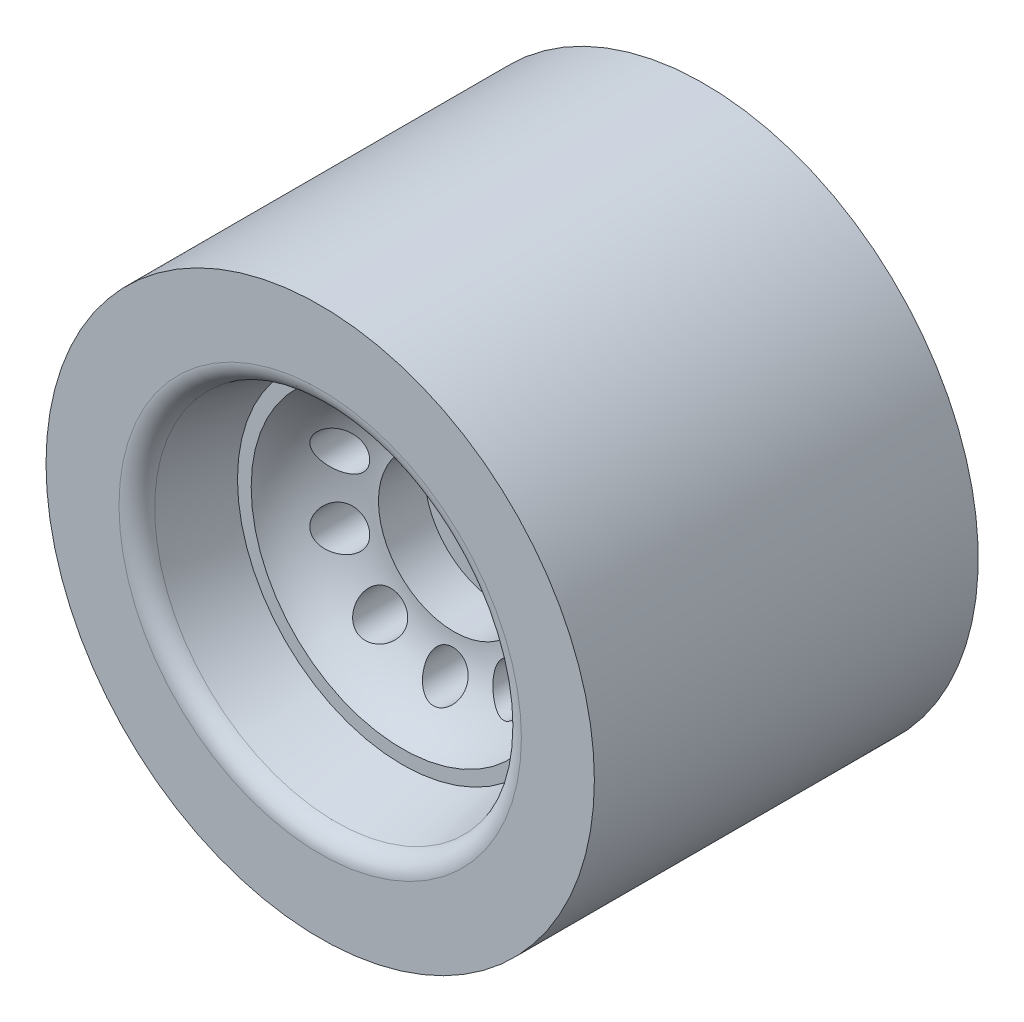
from build123d import *

# Parameters (mm, degrees)
SKETCH_1_R               = 40
EXTRUDE_1_DEPTH          = 28
SKETCH_2_R               = 8.5
CUT_EXTRUDE_1_DEPTH      = 80.598994969
SKETCH_5_R               = 3
CUT_EXTRUDE_2_DEPTH      = 64.118935352
PATTERN_CIRCULAR_1_COUNT = 10
FILLET_1_R               = 3
SKETCH_6_R               = 11
CUT_EXTRUDE_3_DEPTH      = 6.75
CUT_EXTRUDE_START        = -6.75
SKETCH_7_R               = 11
CUT_EXTRUDE_4_DEPTH      = 6.75


with BuildPart() as part:
    # 스케치1 → 보스-돌출1 (new, symmetric)
    with BuildSketch(Plane.XY):
        Circle(SKETCH_1_R)
    extrude(amount=EXTRUDE_1_DEPTH, both=True)

    # 스케치2 → 컷-돌출1 (cut, through all)
    with BuildSketch(Plane.XY.offset(28)):
        Circle(SKETCH_2_R)
    extrude(amount=-CUT_EXTRUDE_1_DEPTH, mode=Mode.SUBTRACT)

    # 스케치4 → 컷-회전1 (revolve, cut)
    with BuildSketch(Plane(origin=(0, 0, 0), x_dir=(0, 0, -1), z_dir=(1, 0, 0)), mode=Mode.PRIVATE) as cut_revolve_1_sk:
        with BuildLine():
            Line((28, 40), (26.6, 33.9))
            Line((26.6, 33.9), (25.6, 33.4))
            ThreePointArc((25.6, 33.4), (25.036621757, 30.988428707), (24.205776693, 28.655454719))
            ThreePointArc((24.205776693, 28.655454719), (23.141333629, 25.422089147), (22.6083716, 22.06))
            ThreePointArc((22.6083716, 22.06), (17.154433029, 17.683921829), (15.1, 11))
            Line((15.1, 11), (15.1, 0))
            Line((15.1, 0), (28, 0))
            Line((28, 0), (28, 40))
        make_face()
        with BuildLine():
            Line((-28, 0), (-28, 27))
            Line((-28, 27), (-16.0083716, 24.06))
            Line((-16.0083716, 24.06), (-16.0083716, 22.06))
            ThreePointArc((-16.0083716, 22.06), (-10.554433029, 17.683921829), (-8.5, 11))
            Line((-8.5, 11), (-8.5, 0))
            Line((-8.5, 0), (-28, 0))
        make_face()
    revolve(cut_revolve_1_sk.sketch.rotate(Axis((0, 0, -28), (0, 0, 1)), 90), axis=Axis((0, 0, -28), (0, 0, 1)), mode=Mode.SUBTRACT)

    # 스케치5 → 컷-돌출2 (cut, symmetric)
    with BuildSketch(Plane.XY):
        with Locations(Location((0, 15.875, 0), (0, 0, 222.496466029))):
            Circle(SKETCH_5_R)
    cut_extrude_2 = extrude(amount=CUT_EXTRUDE_2_DEPTH, both=True, mode=Mode.SUBTRACT)

    # 원형 패턴1: 컷-돌출2 ×10 about axis
    pattern_circular_1_axis = Axis((0, 0, 0), (0, 0, 1))
    for i in range(1, PATTERN_CIRCULAR_1_COUNT):
        add(cut_extrude_2.rotate(pattern_circular_1_axis, i * 360 / PATTERN_CIRCULAR_1_COUNT), mode=Mode.SUBTRACT)

    # 필렛1
    fillet_1_edges = [part.edges().sort_by_distance(p)[0] for p in [
        (27, 0, 28),
    ]]
    fillet(fillet_1_edges, radius=FILLET_1_R)

    # 스케치6 → 컷-돌출3 (cut)
    with BuildSketch(Plane.XY.offset(8.5)):
        Circle(SKETCH_6_R)
    extrude(amount=-CUT_EXTRUDE_3_DEPTH, mode=Mode.SUBTRACT)

    # 스케치7 → 컷-돌출4 (cut)
    with BuildSketch(Plane(origin=(0, 0, -15.1), x_dir=(-1, 0, 0), z_dir=(0, 0, -1)).offset(CUT_EXTRUDE_START)):
        with Locations(Location((0, 0, 0), (0, 0, 180))):
            Circle(SKETCH_7_R)
    extrude(amount=CUT_EXTRUDE_4_DEPTH, mode=Mode.SUBTRACT)


solid = part.part
